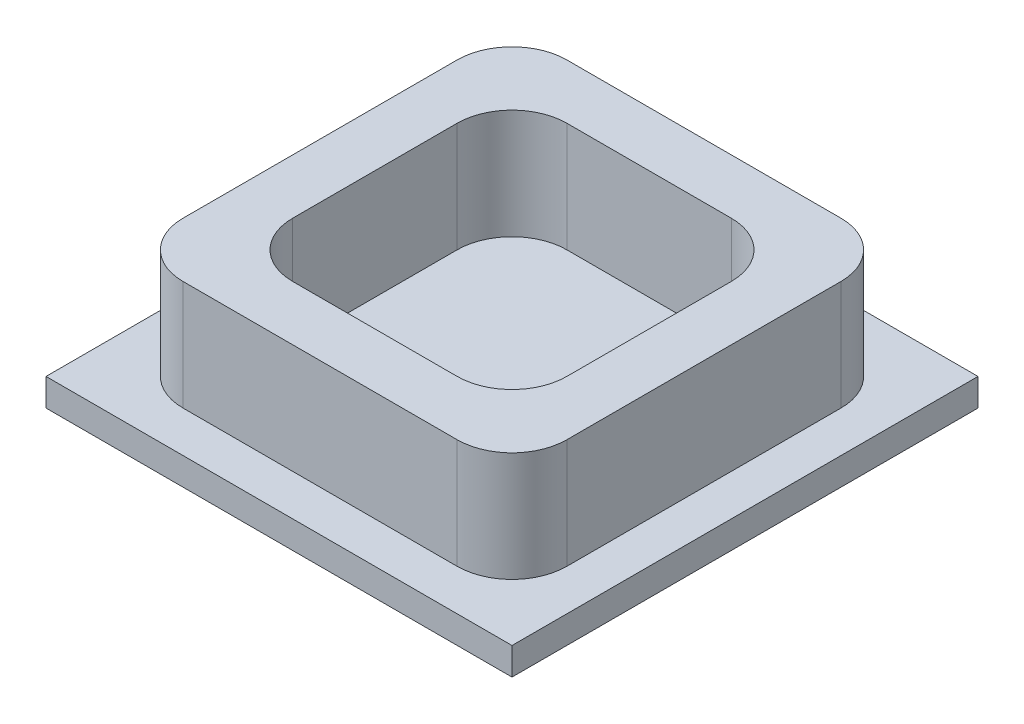
from build123d import *

# Parameters (mm, degrees)
SKETCH1_W           = 17
SKETCH1_H           = 17
BOSS_EXTRUDE1_DEPTH = 1
SKETCH2_W           = 14
SKETCH2_H           = 14
SKETCH2_W_2         = 10
SKETCH2_H_2         = 10
BOSS_EXTRUDE2_DEPTH = 4
FILLET1_R           = 2


with BuildPart() as part:
    # Sketch1 → Boss-Extrude1 (new body)
    with BuildSketch(Plane(origin=(0, 0, 0), x_dir=(1, 0, 0), z_dir=(0, 1, 0))):
        Rectangle(SKETCH1_W, SKETCH1_H)
    extrude(amount=BOSS_EXTRUDE1_DEPTH)

    # Sketch2 → Boss-Extrude2 (add)
    with BuildSketch(Plane(origin=(0, 1, 0), x_dir=(1, 0, 0), z_dir=(0, 1, 0))):
        Rectangle(SKETCH2_W, SKETCH2_H)
        Rectangle(SKETCH2_W_2, SKETCH2_H_2, mode=Mode.SUBTRACT)
    extrude(amount=BOSS_EXTRUDE2_DEPTH)

    # Fillet1
    fillet1_edges = [part.edges().sort_by_distance(p)[0] for p in [
        (7, 3, 7),
        (7, 3, -7),
        (-7, 3, -7),
        (-7, 3, 7),
        (-5, 3, -5),
        (-5, 3, 5),
        (5, 3, 5),
        (5, 3, -5),
    ]]
    fillet(fillet1_edges, radius=FILLET1_R)


solid = part.part
